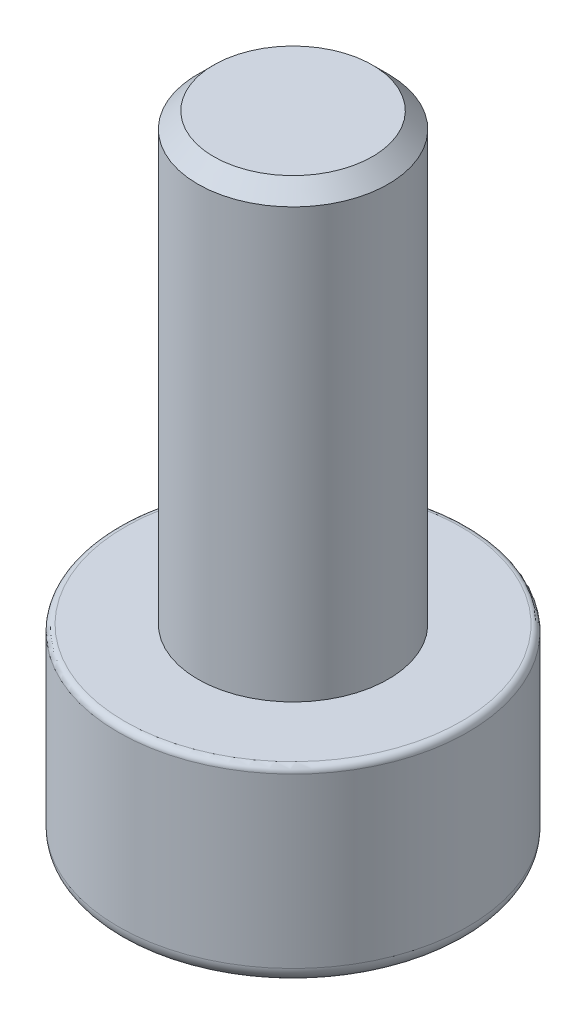
from build123d import *

# Parameters (mm, degrees)
SKETCH1_R           = 2.75
BOSS_EXTRUDE1_DEPTH = 3
SKETCH2_R           = 1.5
BOSS_EXTRUDE2_DEPTH = 7
CUT_EXTRUDE1_DEPTH  = 1.5
CHAMFER1_SIZE       = 0.25
FILLET1_R           = 0.25
CHAMFER2_SIZE       = 0.25
FILLET2_R           = 0.1


with BuildPart() as part:
    # Sketch1 → Boss-Extrude1 (new body)
    with BuildSketch(Plane(origin=(0, 0, 0), x_dir=(1, 0, 0), z_dir=(0, 1, 0))):
        with Locations(Location((0, 0, 0), (0, 0, 270))):
            Circle(SKETCH1_R)
    extrude(amount=BOSS_EXTRUDE1_DEPTH)

    # Sketch2 → Boss-Extrude2 (add)
    with BuildSketch(Plane(origin=(0, 3, 0), x_dir=(1, 0, 0), z_dir=(0, 1, 0))):
        with Locations(Location((0, 0, 0), (0, 0, 270))):
            Circle(SKETCH2_R)
    extrude(amount=BOSS_EXTRUDE2_DEPTH)

    # Sketch3 → Cut-Extrude1 (cut)
    with BuildSketch(Plane.XZ):
        Polygon((0.934168857, 0.974591477), (-0.376936549, 1.2963097), (-1.311105406, 0.321718223), (-0.934168857, -0.974591477), (0.376936549, -1.2963097), (1.311105406, -0.321718223), align=None)
    extrude(amount=-CUT_EXTRUDE1_DEPTH, mode=Mode.SUBTRACT)

    # Chamfer1
    chamfer1_edges = [part.edges().sort_by_distance(p)[0] for p in [
        (1.122637131, 0, 0.326436627),
        (0.278616154, 0, 1.135450588),
        (-0.844020977, 0, 0.809013962),
        (-1.122637131, 0, -0.326436627),
        (-0.278616154, 0, -1.135450588),
        (0.844020977, 0, -0.809013962),
    ]]
    chamfer(chamfer1_edges, length=CHAMFER1_SIZE)

    # Fillet1
    fillet1_edges = [part.edges().sort_by_distance(p)[0] for p in [
        (0, 0, -2.75),
    ]]
    fillet(fillet1_edges, radius=FILLET1_R)

    # Chamfer2
    chamfer2_edges = [part.edges().sort_by_distance(p)[0] for p in [
        (0, 10, -1.5),
    ]]
    chamfer(chamfer2_edges, length=CHAMFER2_SIZE)

    # Fillet2
    fillet2_edges = [part.edges().sort_by_distance(p)[0] for p in [
        (0, 3, -2.75),
    ]]
    fillet(fillet2_edges, radius=FILLET2_R)


solid = part.part
